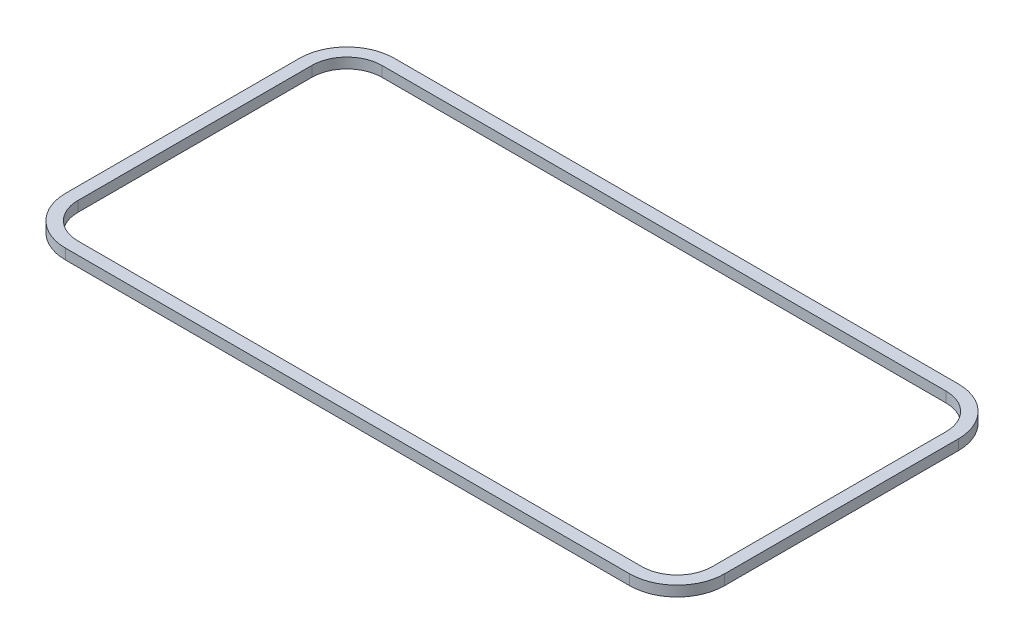
from build123d import *

# Parameters (mm, degrees)
GASKET_START = -1.5
GASKET_DEPTH = 1.5


with BuildPart() as part:
    # Sketch1 → Gasket (new body)
    with BuildSketch(Plane(origin=(0, 0, 0), x_dir=(1, 0, 0), z_dir=(0, 1, 0)).offset(GASKET_START)):
        with BuildLine():
            Line((-41, -23.9), (41, -23.9))
            ThreePointArc((41, -23.9), (45.87903679, -21.87903679), (47.9, -17))
            Line((47.9, -17), (47.9, 17))
            ThreePointArc((47.9, 17), (45.87903679, 21.87903679), (41, 23.9))
            Line((41, 23.9), (-41, 23.9))
            ThreePointArc((-41, 23.9), (-45.87903679, 21.87903679), (-47.9, 17))
            Line((-47.9, 17), (-47.9, -17))
            ThreePointArc((-47.9, -17), (-45.87903679, -21.87903679), (-41, -23.9))
        make_face()
        with BuildLine():
            Line((-41, -22.1), (41, -22.1))
            ThreePointArc((41, -22.1), (44.606244584, -20.606244584), (46.1, -17))
            Line((46.1, -17), (46.1, 17))
            ThreePointArc((46.1, 17), (44.606244584, 20.606244584), (41, 22.1))
            Line((41, 22.1), (-41, 22.1))
            ThreePointArc((-41, 22.1), (-44.606244584, 20.606244584), (-46.1, 17))
            Line((-46.1, 17), (-46.1, -17))
            ThreePointArc((-46.1, -17), (-44.606244584, -20.606244584), (-41, -22.1))
        make_face(mode=Mode.SUBTRACT)
    extrude(amount=GASKET_DEPTH)


solid = part.part
